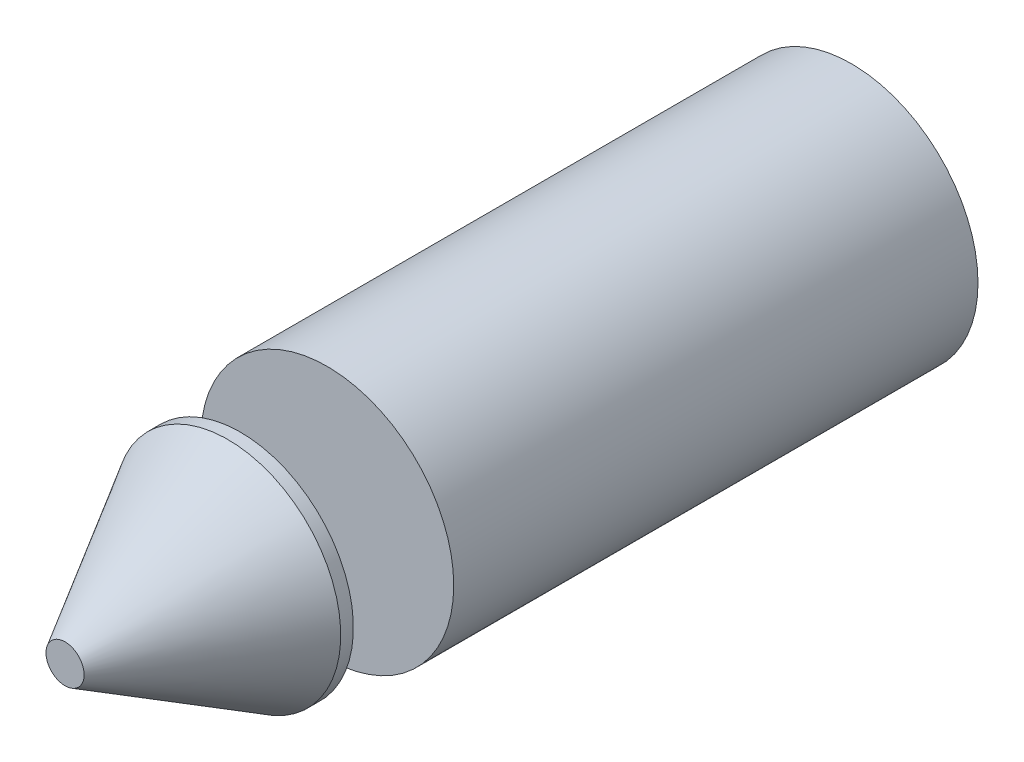
from build123d import *

# Parameters (mm, degrees)
SKETCH1_R           = 17.78
BOSS_EXTRUDE1_DEPTH = 73.66
SKETCH2_R           = 15.875
BOSS_EXTRUDE2_DEPTH = 24.638
CHAMFER1_SIZE       = 22.86
CHAMFER1_SIZE2      = 13.198227154


with BuildPart() as part:
    # Sketch1 → Boss-Extrude1 (new body)
    with BuildSketch(Plane.XY):
        Circle(SKETCH1_R)
    extrude(amount=BOSS_EXTRUDE1_DEPTH)


with BuildPart() as body_2:
    # Sketch2 → Boss-Extrude2 (new body)
    with BuildSketch(Plane.XY.offset(85.852)):
        with Locations(Location((0, 0, 0), (0, 0, 180))):
            Circle(SKETCH2_R)
    extrude(amount=BOSS_EXTRUDE2_DEPTH)

    # Chamfer1
    chamfer1_edges = [body_2.edges().sort_by_distance(p)[0] for p in [
        (15.875, 0, 110.49),
    ]]
    chamfer1_side = [body_2.faces().sort_by_distance(p)[0] for p in [
        (15.875, 0, 98.171),
    ]]
    chamfer(chamfer1_edges, length=CHAMFER1_SIZE, length2=CHAMFER1_SIZE2, reference=chamfer1_side[0])


solid = Compound([part.part, body_2.part])
